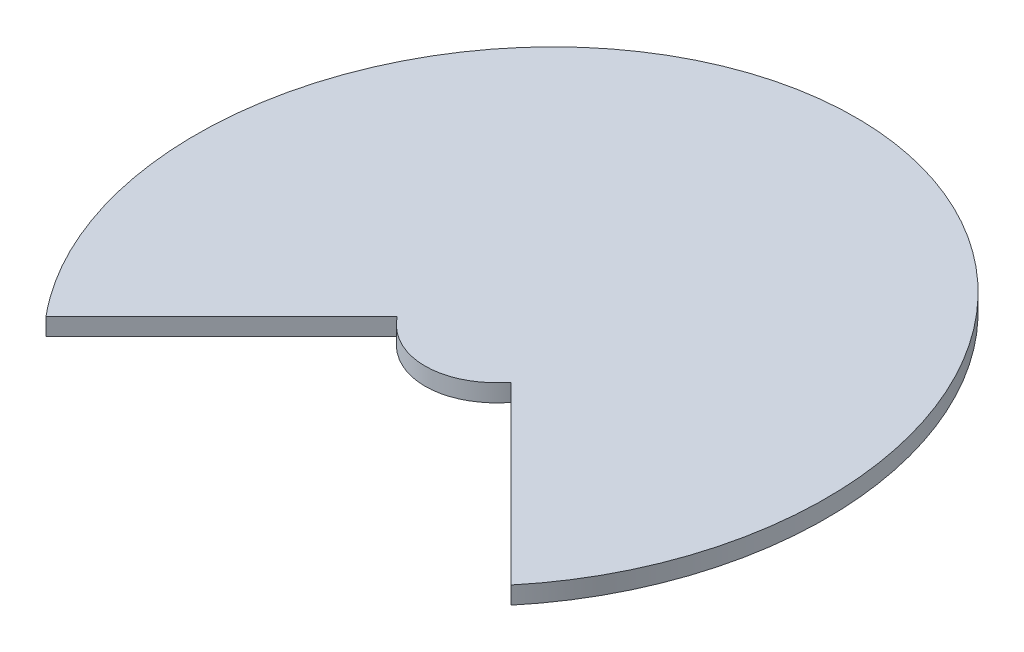
from build123d import *

# Parameters (mm, degrees)
BOSS_EXTRUDE1_DEPTH = 6.35


with BuildPart() as part:
    # Sketch1 → Boss-Extrude1 (new body)
    with BuildSketch(Plane(origin=(0, 0, 0), x_dir=(1, 0, 0), z_dir=(0, 1, 0))):
        with BuildLine():
            Line((-38.437837367, 79.924559515), (-102.136880846, 16.225516036))
            add(Edge.make_bspline(
                [(66.61589765, 16.225516036), (241.524632013, 225.681665284), (-17.760491598, 225.681665284), (-277.045615209, 225.681665284), (-102.136880846, 16.225516036)],
                knots=[0.830399805, 0.830399805, 0.830399805, 3.141592654, 3.141592654, 5.452785502, 5.452785502, 5.452785502], degree=2, weights=[1, 0.403372856, 1, 0.403372856, 1]))
            Line((66.61589765, 16.225516036), (2.916854172, 79.924559515))
            add(Edge.make_bspline(
                [(-38.437837367, 79.924559515), (-17.760491598, 53.514716221), (2.916854172, 79.924559515)],
                knots=[5.436764674, 5.436764674, 5.436764674, 7.129605941, 7.129605941, 7.129605941], degree=2, weights=[1, 0.66266802, 1]))
        make_face()
    extrude(amount=BOSS_EXTRUDE1_DEPTH)


solid = part.part
